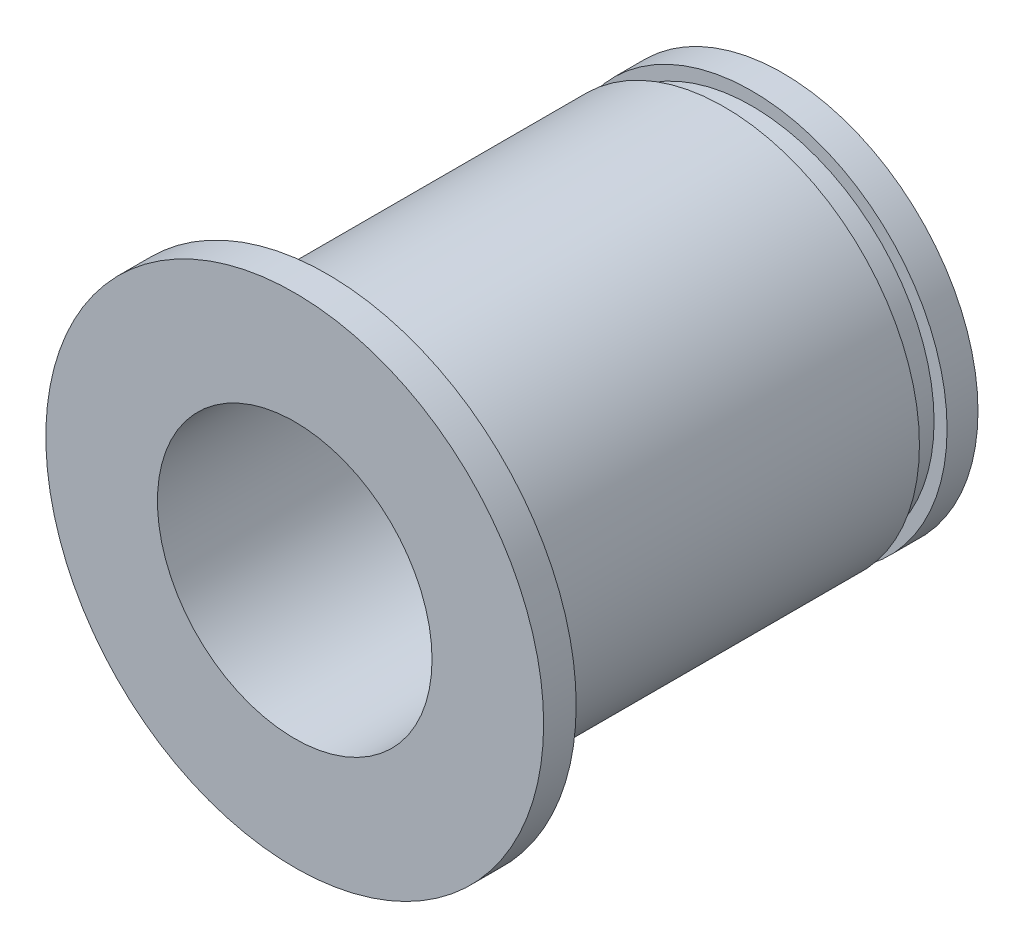
from build123d import *

# Parameters (mm, degrees)
F_01_START                                = -2
S01_GROUND_GUIDE_BORE_AND_BODY_R          = 6
S01_GROUND_GUIDE_BORE_AND_BODY_R_2        = 4.22
F_01_GROUND_GUIDE_BORE_AND_BODY_DEPTH     = 14
F_02_START                                = 12
S02_OUTBOARD_FLANGE_R                     = 7.65
S02_OUTBOARD_FLANGE_R_2                   = 4.22
F_02_OUTBOARD_FLANGE_DEPTH                = 1
F_03_START                                = -1.05
S03_EXTERNAL_RETAINING_RING_GROOVE_R      = 6.1
S03_EXTERNAL_RETAINING_RING_GROOVE_R_2    = 5.6
F_03_EXTERNAL_RETAINING_RING_GROOVE_DEPTH = 0.85


with BuildPart() as part:
    # S01 - Ground guide bore and body → 01 - Ground guide bore and body (new body)
    with BuildSketch(Plane.XY.offset(F_01_START)):
        Circle(S01_GROUND_GUIDE_BORE_AND_BODY_R)
        Circle(S01_GROUND_GUIDE_BORE_AND_BODY_R_2, mode=Mode.SUBTRACT)
    extrude(amount=F_01_GROUND_GUIDE_BORE_AND_BODY_DEPTH)

    # S02 - Outboard flange → 02 - Outboard flange (add)
    with BuildSketch(Plane.XY.offset(F_02_START)):
        Circle(S02_OUTBOARD_FLANGE_R)
        Circle(S02_OUTBOARD_FLANGE_R_2, mode=Mode.SUBTRACT)
    extrude(amount=F_02_OUTBOARD_FLANGE_DEPTH)

    # S03 - External retaining ring groove → 03 - External retaining ring groove (cut)
    with BuildSketch(Plane.XY.offset(F_03_START)):
        Circle(S03_EXTERNAL_RETAINING_RING_GROOVE_R)
        Circle(S03_EXTERNAL_RETAINING_RING_GROOVE_R_2, mode=Mode.SUBTRACT)
    extrude(amount=F_03_EXTERNAL_RETAINING_RING_GROOVE_DEPTH, mode=Mode.SUBTRACT)


solid = part.part
